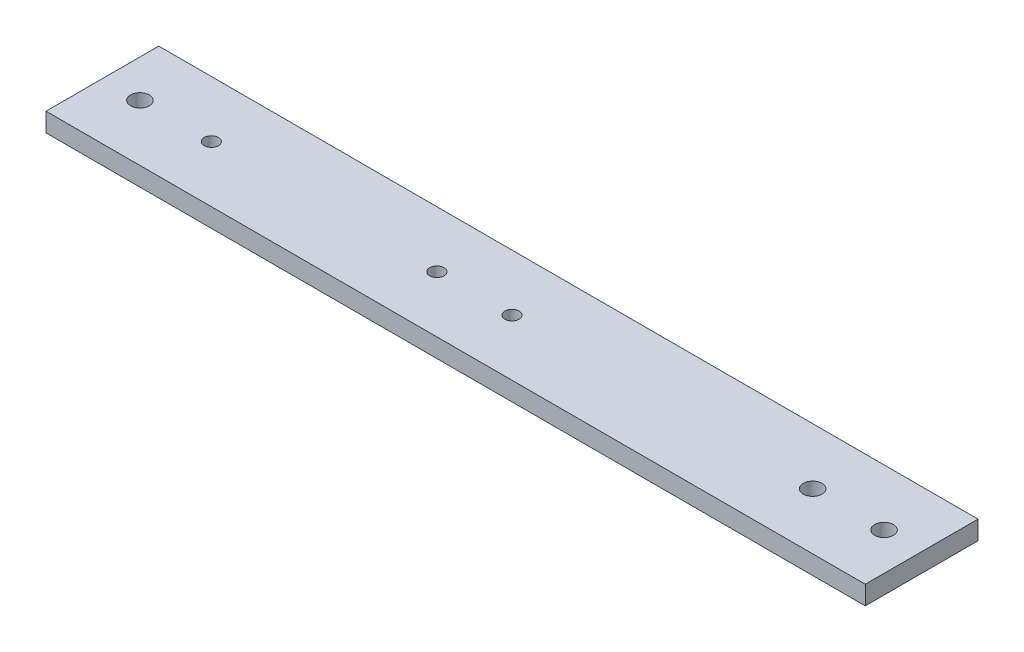
from build123d import *

# Parameters (mm, degrees)
SKETCH1_W           = 276.86
SKETCH1_H           = 38.1
SKETCH1_R           = 3.175
SKETCH1_R_2         = 2.413
BOSS_EXTRUDE1_DEPTH = 6.35


with BuildPart() as part:
    # Sketch1 → Boss-Extrude1 (new body)
    with BuildSketch(Plane(origin=(0, 0, 0), x_dir=(1, 0, 0), z_dir=(0, 1, 0))):
        Rectangle(SKETCH1_W, SKETCH1_H)
        with Locations(Location((-125.73, 0, 0), (0, 0, 270))):
            Circle(SKETCH1_R, mode=Mode.SUBTRACT)
        with Locations(Location((125.73, 0, 0), (0, 0, 270))):
            Circle(SKETCH1_R, mode=Mode.SUBTRACT)
        with Locations(Location((-101.6, 0, 0), (0, 0, 270))):
            Circle(SKETCH1_R_2, mode=Mode.SUBTRACT)
        with Locations(Location((-25.4, 0, 0), (0, 0, 270))):
            Circle(SKETCH1_R_2, mode=Mode.SUBTRACT)
        with Locations(Location((0, 0, 0), (0, 0, 270))):
            Circle(SKETCH1_R_2, mode=Mode.SUBTRACT)
        with Locations(Location((101.6, 0, 0), (0, 0, 270))):
            Circle(SKETCH1_R, mode=Mode.SUBTRACT)
    extrude(amount=BOSS_EXTRUDE1_DEPTH)


solid = part.part
